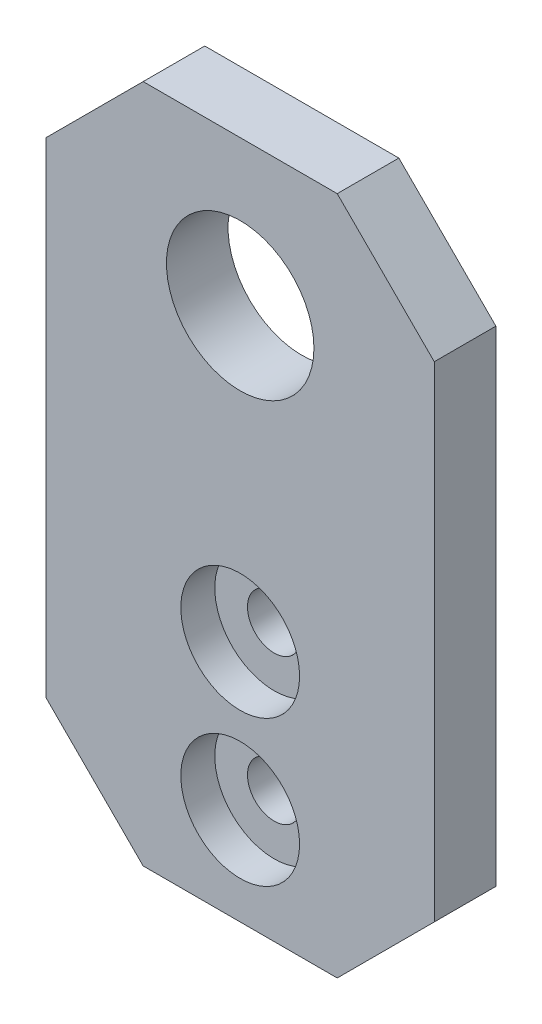
from build123d import *

# Parameters (mm, degrees)
SKETCH1_W                               = 40
SKETCH1_H                               = 70
SKETCH1_R                               = 7.6
BOSS_EXTRUDE1_DEPTH                     = 6.35
CBORE_FOR_M5_HEX_HEAD_BOLT1_D           = 5.5
CBORE_FOR_M5_HEX_HEAD_BOLT1_CBORE_D     = 12.238
CBORE_FOR_M5_HEX_HEAD_BOLT1_CBORE_DEPTH = 3.5
CHAMFER1_SIZE                           = 10


with BuildPart() as part:
    # Sketch1 → Boss-Extrude1 (new body)
    with BuildSketch(Plane.XY):
        Rectangle(SKETCH1_W, SKETCH1_H)
        with Locations((0, 20)):
            Circle(SKETCH1_R, mode=Mode.SUBTRACT)
    extrude(amount=BOSS_EXTRUDE1_DEPTH)

    # CBORE for M5 Hex Head Bolt1 (through all)
    with Locations(Plane.XY.offset(6.35)):
        with Locations((0, -10), (0, -25)):
            CounterBoreHole(CBORE_FOR_M5_HEX_HEAD_BOLT1_D / 2, CBORE_FOR_M5_HEX_HEAD_BOLT1_CBORE_D / 2, CBORE_FOR_M5_HEX_HEAD_BOLT1_CBORE_DEPTH)

    # Chamfer1
    chamfer1_edges = [part.edges().sort_by_distance(p)[0] for p in [
        (-20, 35, 3.175),
        (20, 35, 3.175),
        (20, -35, 3.175),
        (-20, -35, 3.175),
    ]]
    chamfer(chamfer1_edges, length=CHAMFER1_SIZE)


solid = part.part
